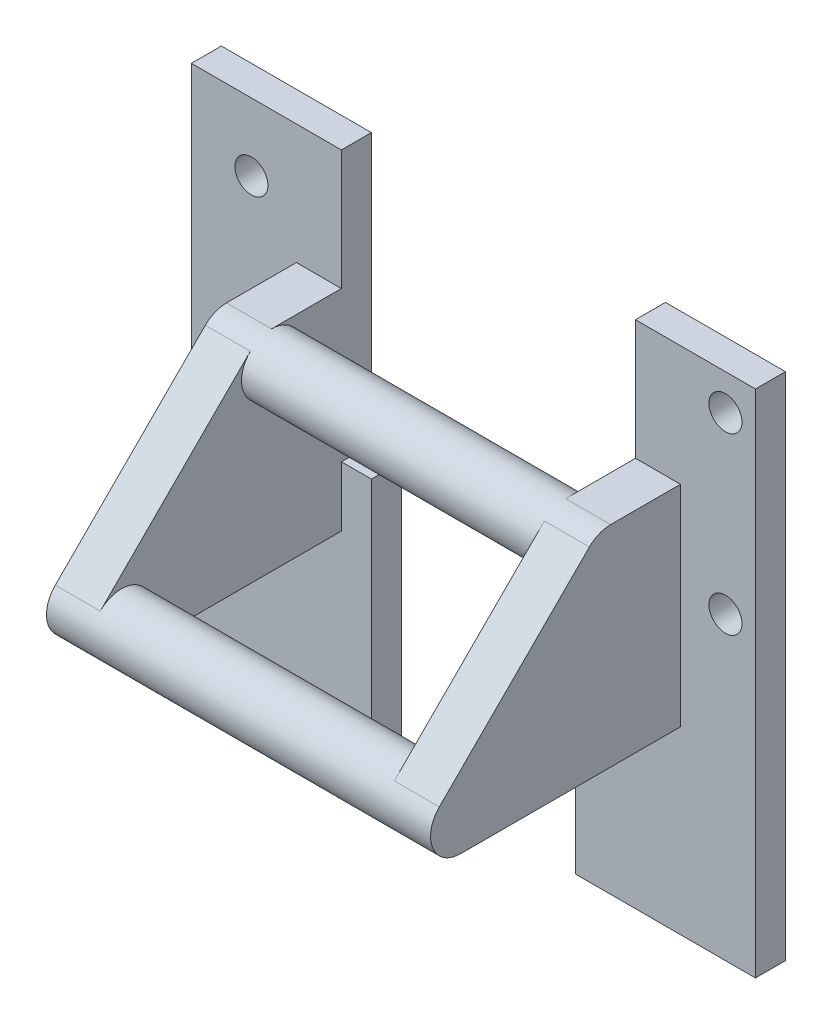
from build123d import *

# Parameters (mm, degrees)
SKETCH2_R             = 2.75
BOSS_EXTRUDE1_DEPTH   = 5
BOSS_EXTRUDE1_2_DEPTH = 5
BOSS_EXTRUDE3_DEPTH   = 2.5
BOSS_EXTRUDE4_DEPTH   = 2.5
BOSS_EXTRUDE5_DEPTH   = 5
BOSS_EXTRUDE6_DEPTH   = 5
FILLET1_R             = 5
FILLET2_R             = 5
FILLET3_R             = 5
FILLET4_R             = 5
SKETCH7_R             = 5
BOSS_EXTRUDE7_DEPTH   = 49
BOSS_EXTRUDE8_START   = 49
SKETCH8_R             = 5
BOSS_EXTRUDE8_DEPTH   = 49


with BuildPart() as part:
    # Sketch2 → Boss-Extrude1 (new body)
    with BuildSketch(Plane.XY):
        Polygon((-10, -75), (-10, -115), (20, -115), (20, -30), (5, -30), (5, -75), align=None)
        with Locations((15, -35.919713403)):
            Circle(SKETCH2_R, mode=Mode.SUBTRACT)
        with Locations((15, -65)):
            Circle(SKETCH2_R, mode=Mode.SUBTRACT)
    extrude(amount=BOSS_EXTRUDE1_DEPTH)

    # Sketch4 → Boss-Extrude4 (add)
    with BuildSketch(Plane.ZY.offset(-5)):
        Polygon((0, -30), (0, -75), (5, -75), (5, -85), (53.715728753, -85), (18.715728753, -50), (5, -50), (5, -30), align=None)
    extrude(amount=-BOSS_EXTRUDE4_DEPTH)

    # Sketch6 → Boss-Extrude6 (add)
    with BuildSketch(Plane.ZY.offset(-5)):
        Polygon((0, -30), (0, -75), (5, -75), (5, -85), (53.715728753, -85), (18.715728753, -50), (5, -50), (5, -30), align=None)
    extrude(amount=BOSS_EXTRUDE6_DEPTH)

    # Fillet1
    fillet1_edges = [part.edges().sort_by_distance(p)[0] for p in [
        (3.75, -85, 53.715728753),
    ]]
    fillet(fillet1_edges, radius=FILLET1_R)

    # Fillet4
    fillet4_edges = [part.edges().sort_by_distance(p)[0] for p in [
        (3.75, -50, 18.715728753),
    ]]
    fillet(fillet4_edges, radius=FILLET4_R)



with BuildPart() as body_2:
    # Sketch2 → Boss-Extrude1 2 (new body)
    with BuildSketch(Plane.XY):
        Polygon((-74, -30), (-74, -115), (-44, -115), (-44, -75), (-54, -75), (-54, -30), align=None)
        with Locations((-64, -65)):
            Circle(SKETCH2_R, mode=Mode.SUBTRACT)
        with Locations((-64, -41.25)):
            Circle(SKETCH2_R, mode=Mode.SUBTRACT)
    extrude(amount=BOSS_EXTRUDE1_2_DEPTH)

    # Sketch3 → Boss-Extrude3 (add)
    with BuildSketch(Plane(origin=(-54, 0, 0), x_dir=(0, 0, -1), z_dir=(1, 0, 0))):
        Polygon((-5, -75), (-5, -50), (-18.715728753, -50), (-53.715728753, -85), (-5, -85), align=None)
    extrude(amount=-BOSS_EXTRUDE3_DEPTH)

    # Sketch5 → Boss-Extrude5 (add)
    with BuildSketch(Plane(origin=(-54, 0, 0), x_dir=(0, 0, -1), z_dir=(1, 0, 0))):
        Polygon((0, -75), (0, -30), (-5, -30), (-5, -50), (-18.715728753, -50), (-53.715728753, -85), (-5, -85), (-5, -75), align=None)
    extrude(amount=BOSS_EXTRUDE5_DEPTH)

    # Fillet2
    fillet2_edges = [body_2.edges().sort_by_distance(p)[0] for p in [
        (-52.75, -85, 53.715728753),
    ]]
    fillet(fillet2_edges, radius=FILLET2_R)

    # Fillet3
    fillet3_edges = [body_2.edges().sort_by_distance(p)[0] for p in [
        (-52.75, -50, 18.715728753),
    ]]
    fillet(fillet3_edges, radius=FILLET3_R)


with BuildPart() as part_1:
    add(part.part)

    add(body_2.part)  # Boss-Extrude7 merges body 2
    # Sketch7 → Boss-Extrude7 (add)
    with BuildSketch(Plane(origin=(-49, 0, 0), x_dir=(0, 0, -1), z_dir=(1, 0, 0))):
        with Locations(Location((-41.644660941, -80, 0), (0, 0, 135))):
            Circle(SKETCH7_R)
    extrude(amount=BOSS_EXTRUDE7_DEPTH)

    # Sketch8 → Boss-Extrude8 (add)
    with BuildSketch(Plane(origin=(-49, 0, 0), x_dir=(0, 0, -1), z_dir=(1, 0, 0)).offset(BOSS_EXTRUDE8_START)):
        with Locations(Location((-16.644660941, -55, 0), (0, 0, 90))):
            Circle(SKETCH8_R)
    extrude(amount=-BOSS_EXTRUDE8_DEPTH)


solid = part_1.part
